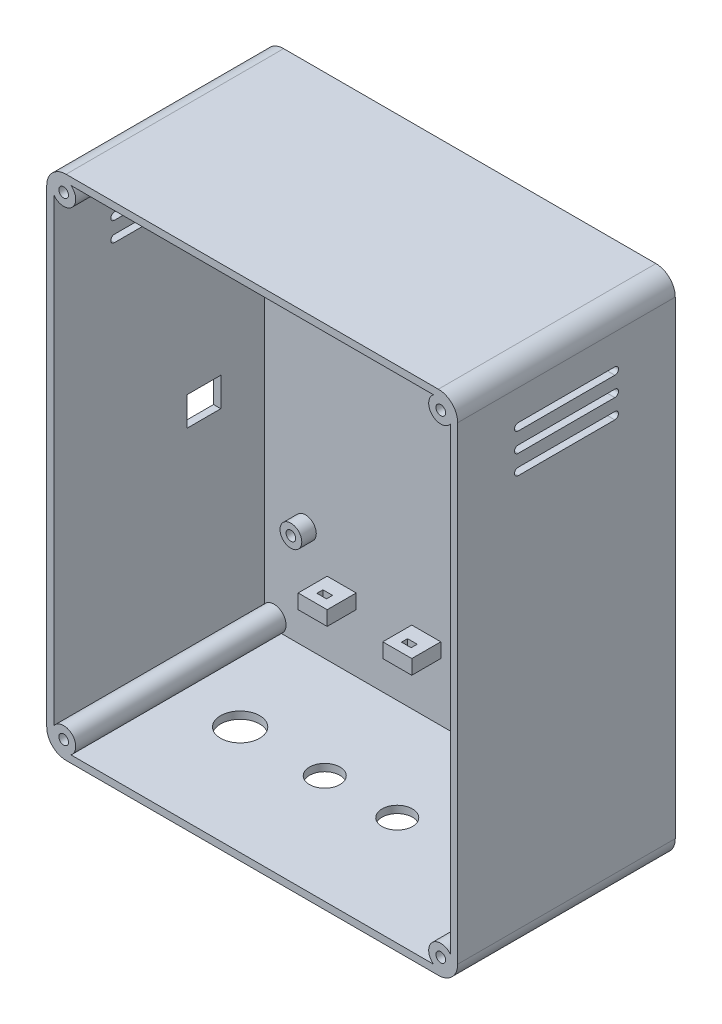
from build123d import *

# Parameters (mm, degrees)
BLOCK_DEPTH                    = 90
SHELL1_T                       = -3
SKETCH2_R                      = 5
CORNER_COLUMNS_DEPTH           = 90
SKETCH3_R                      = 2
FRONT_PANEL_INSERT_HOLES_DEPTH = 7
SKETCH4_R                      = 4.5
PLATE_BOSSES_DEPTH             = 6
SKETCH5_R                      = 2
PLATE_INSERT_HOLES_DEPTH       = 7
SKETCH6_R                      = 8.1
SKETCH6_R_2                    = 6.3
CABLE_GLAND_HOLES_DEPTH        = 4
SKETCH7_W                      = 12
SKETCH7_H                      = 6
CABLE_TIE_BARS_DEPTH           = 12
SKETCH8_W                      = 4
SKETCH8_H                      = 2.5
CABLE_TIE_SLOTS_DEPTH          = 6.02
SKETCH9_W                      = 14
SKETCH9_H                      = 12
USB_ACCESS_DEPTH               = 4
VENTS_LEFT_DEPTH               = 4
VENTS_START                    = -4
VENTS_RIGHT_DEPTH              = 4
SKETCH12_R                     = 4.75
KEYHOLE_HEADS_DEPTH            = 4
KEYHOLE_SLOTS_DEPTH            = 4


with BuildPart() as part:
    # Sketch1 → Block (new body)
    with BuildSketch(Plane.XY):
        with BuildLine():
            Line((-77, 0), (77, 0))
            ThreePointArc((77, 0), (82.656854249, 2.343145751), (85, 8))
            Line((85, 8), (85, 202))
            ThreePointArc((85, 202), (82.656854249, 207.656854249), (77, 210))
            Line((77, 210), (-77, 210))
            ThreePointArc((-77, 210), (-82.656854249, 207.656854249), (-85, 202))
            Line((-85, 202), (-85, 8))
            ThreePointArc((-85, 8), (-82.656854249, 2.343145751), (-77, 0))
        make_face()
    extrude(amount=BLOCK_DEPTH)

    # Shell1
    shell1_openings = [part.faces().sort_by_distance(p)[0] for p in [
        (0, 105, 90),
    ]]
    offset(amount=SHELL1_T, openings=shell1_openings, kind=Kind.INTERSECTION)

    # Sketch2 → Corner columns (add)
    with BuildSketch(Plane.XY):
        with Locations((-78, 7)):
            Circle(SKETCH2_R)
        with Locations((78, 7)):
            Circle(SKETCH2_R)
        with Locations((-78, 203)):
            Circle(SKETCH2_R)
        with Locations((78, 203)):
            Circle(SKETCH2_R)
    extrude(amount=CORNER_COLUMNS_DEPTH)

    # Sketch3 → Front panel insert holes (cut)
    with BuildSketch(Plane.XY.offset(90)):
        with Locations((-78, 7)):
            Circle(SKETCH3_R)
        with Locations((78, 7)):
            Circle(SKETCH3_R)
        with Locations((-78, 203)):
            Circle(SKETCH3_R)
        with Locations((78, 203)):
            Circle(SKETCH3_R)
    extrude(amount=-FRONT_PANEL_INSERT_HOLES_DEPTH, mode=Mode.SUBTRACT)

    # Sketch4 → Plate bosses (add)
    with BuildSketch(Plane.XY.offset(3)):
        with Locations((-65, 46)):
            Circle(SKETCH4_R)
        with Locations((65, 46)):
            Circle(SKETCH4_R)
        with Locations((-65, 190)):
            Circle(SKETCH4_R)
        with Locations((65, 190)):
            Circle(SKETCH4_R)
    extrude(amount=PLATE_BOSSES_DEPTH)

    # Sketch5 → Plate insert holes (cut)
    with BuildSketch(Plane.XY.offset(9)):
        with Locations((-65, 46)):
            Circle(SKETCH5_R)
        with Locations((65, 46)):
            Circle(SKETCH5_R)
        with Locations((-65, 190)):
            Circle(SKETCH5_R)
        with Locations((65, 190)):
            Circle(SKETCH5_R)
    extrude(amount=-PLATE_INSERT_HOLES_DEPTH, mode=Mode.SUBTRACT)

    # Sketch6 → Cable gland holes (cut)
    with BuildSketch(Plane(origin=(0, 0, 0), x_dir=(1, 0, 0), z_dir=(0, 1, 0))):
        with Locations(Location((-50, -45, 0), (0, 0, 270))):
            Circle(SKETCH6_R)
        with Locations(Location((-15, -45, 0), (0, 0, 270))):
            Circle(SKETCH6_R_2)
        with Locations(Location((15, -45, 0), (0, 0, 270))):
            Circle(SKETCH6_R_2)
        with Locations(Location((50, -45, 0), (0, 0, 270))):
            Circle(SKETCH6_R_2)
    extrude(amount=CABLE_GLAND_HOLES_DEPTH, mode=Mode.SUBTRACT)

    # Sketch7 → Cable tie bars (add)
    with BuildSketch(Plane.XY.offset(3)):
        with Locations((-50, 30)):
            Rectangle(SKETCH7_W, SKETCH7_H)
        with Locations((-15, 30)):
            Rectangle(SKETCH7_W, SKETCH7_H)
        with Locations((15, 30)):
            Rectangle(SKETCH7_W, SKETCH7_H)
        with Locations((50, 30)):
            Rectangle(SKETCH7_W, SKETCH7_H)
    extrude(amount=CABLE_TIE_BARS_DEPTH)

    # Sketch8 → Cable tie slots (cut)
    with BuildSketch(Plane(origin=(0, 26.99, 0), x_dir=(1, 0, 0), z_dir=(0, 1, 0))):
        with Locations((-50, -10)):
            Rectangle(SKETCH8_W, SKETCH8_H)
        with Locations((-15, -10)):
            Rectangle(SKETCH8_W, SKETCH8_H)
        with Locations((15, -10)):
            Rectangle(SKETCH8_W, SKETCH8_H)
        with Locations((50, -10)):
            Rectangle(SKETCH8_W, SKETCH8_H)
    extrude(amount=CABLE_TIE_SLOTS_DEPTH, mode=Mode.SUBTRACT)

    # Sketch9 → USB access (cut)
    with BuildSketch(Plane(origin=(-85, 0, 0), x_dir=(0, 0, -1), z_dir=(1, 0, 0))):
        with Locations((-28, 95)):
            Rectangle(SKETCH9_W, SKETCH9_H)
    extrude(amount=USB_ACCESS_DEPTH, mode=Mode.SUBTRACT)

    # Sketch10 → Vents left (cut)
    with BuildSketch(Plane(origin=(-85, 0, 0), x_dir=(0, 0, -1), z_dir=(1, 0, 0))):
        with BuildLine():
            Line((-25, 170.5), (-65, 170.5))
            ThreePointArc((-65, 170.5), (-66.5, 172), (-65, 173.5))
            Line((-65, 173.5), (-25, 173.5))
            ThreePointArc((-25, 173.5), (-23.5, 172), (-25, 170.5))
        make_face()
        with BuildLine():
            Line((-25, 178.5), (-65, 178.5))
            ThreePointArc((-65, 178.5), (-66.5, 180), (-65, 181.5))
            Line((-65, 181.5), (-25, 181.5))
            ThreePointArc((-25, 181.5), (-23.5, 180), (-25, 178.5))
        make_face()
        with BuildLine():
            Line((-25, 186.5), (-65, 186.5))
            ThreePointArc((-65, 186.5), (-66.5, 188), (-65, 189.5))
            Line((-65, 189.5), (-25, 189.5))
            ThreePointArc((-25, 189.5), (-23.5, 188), (-25, 186.5))
        make_face()
    extrude(amount=VENTS_LEFT_DEPTH, mode=Mode.SUBTRACT)

    # Sketch11 → Vents right (cut)
    with BuildSketch(Plane(origin=(85, 0, 0), x_dir=(0, 0, -1), z_dir=(1, 0, 0)).offset(VENTS_START)):
        with BuildLine():
            Line((-25, 170.5), (-65, 170.5))
            ThreePointArc((-65, 170.5), (-66.5, 172), (-65, 173.5))
            Line((-65, 173.5), (-25, 173.5))
            ThreePointArc((-25, 173.5), (-23.5, 172), (-25, 170.5))
        make_face()
        with BuildLine():
            Line((-25, 178.5), (-65, 178.5))
            ThreePointArc((-65, 178.5), (-66.5, 180), (-65, 181.5))
            Line((-65, 181.5), (-25, 181.5))
            ThreePointArc((-25, 181.5), (-23.5, 180), (-25, 178.5))
        make_face()
        with BuildLine():
            Line((-25, 186.5), (-65, 186.5))
            ThreePointArc((-65, 186.5), (-66.5, 188), (-65, 189.5))
            Line((-65, 189.5), (-25, 189.5))
            ThreePointArc((-25, 189.5), (-23.5, 188), (-25, 186.5))
        make_face()
    extrude(amount=VENTS_RIGHT_DEPTH, mode=Mode.SUBTRACT)

    # Sketch12 → Keyhole heads (cut)
    with BuildSketch(Plane.XY):
        with Locations((-45, 165)):
            Circle(SKETCH12_R)
        with Locations((45, 165)):
            Circle(SKETCH12_R)
    extrude(amount=KEYHOLE_HEADS_DEPTH, mode=Mode.SUBTRACT)

    # Sketch13 → Keyhole slots (cut)
    with BuildSketch(Plane.XY):
        with BuildLine():
            Line((-47.4, 165), (-47.4, 176))
            ThreePointArc((-47.4, 176), (-45, 178.4), (-42.6, 176))
            Line((-42.6, 176), (-42.6, 165))
            ThreePointArc((-42.6, 165), (-45, 162.6), (-47.4, 165))
        make_face()
        with BuildLine():
            Line((42.6, 165), (42.6, 176))
            ThreePointArc((42.6, 176), (45, 178.4), (47.4, 176))
            Line((47.4, 176), (47.4, 165))
            ThreePointArc((47.4, 165), (45, 162.6), (42.6, 165))
        make_face()
    extrude(amount=KEYHOLE_SLOTS_DEPTH, mode=Mode.SUBTRACT)


solid = part.part
